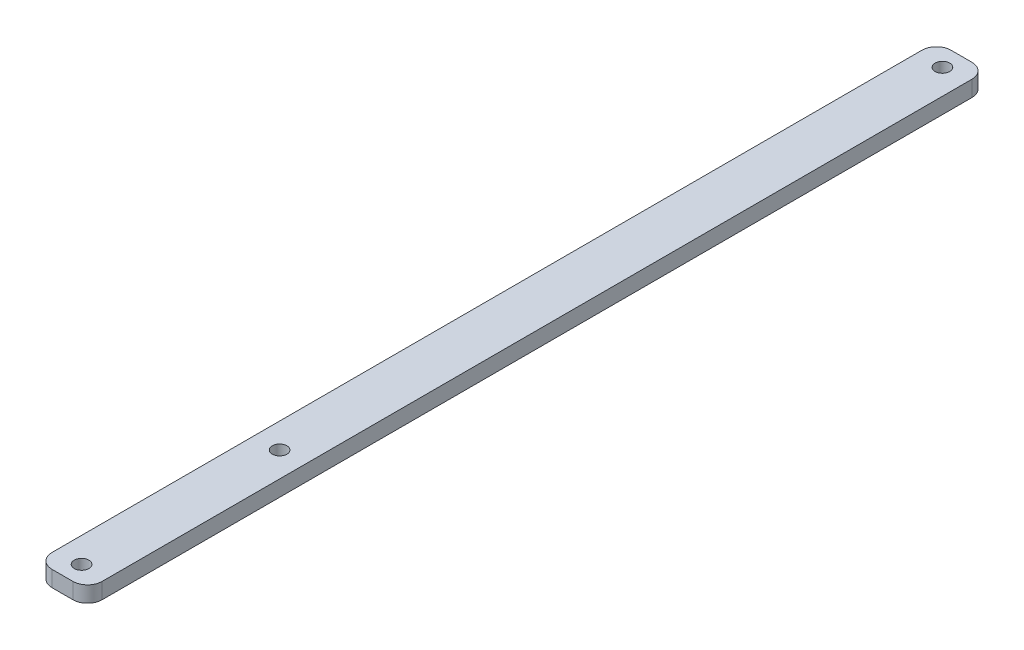
from build123d import *

# Parameters (mm, degrees)
SKETCH1_W           = 10
SKETCH1_H           = 179.31
SKETCH1_R           = 1.4605
BOSS_EXTRUDE1_DEPTH = 3.175
FILLET1_R           = 2.921


with BuildPart() as part:
    # Sketch1 → Boss-Extrude1 (new body)
    with BuildSketch(Plane(origin=(0, 0, 0), x_dir=(1, 0, 0), z_dir=(0, 1, 0))):
        Rectangle(SKETCH1_W, SKETCH1_H)
        with Locations(Location((0, 85.845, 0), (0, 0, 270))):
            Circle(SKETCH1_R, mode=Mode.SUBTRACT)
        with Locations(Location((0, -46.345, 0), (0, 0, 270))):
            Circle(SKETCH1_R, mode=Mode.SUBTRACT)
        with Locations(Location((0, -85.845, 0), (0, 0, 270))):
            Circle(SKETCH1_R, mode=Mode.SUBTRACT)
    extrude(amount=BOSS_EXTRUDE1_DEPTH)

    # Fillet1
    fillet1_edges = [part.edges().sort_by_distance(p)[0] for p in [
        (5, 1.5875, 89.655),
        (-5, 1.5875, 89.655),
        (-5, 1.5875, -89.655),
        (5, 1.5875, -89.655),
    ]]
    fillet(fillet1_edges, radius=FILLET1_R)


solid = part.part
